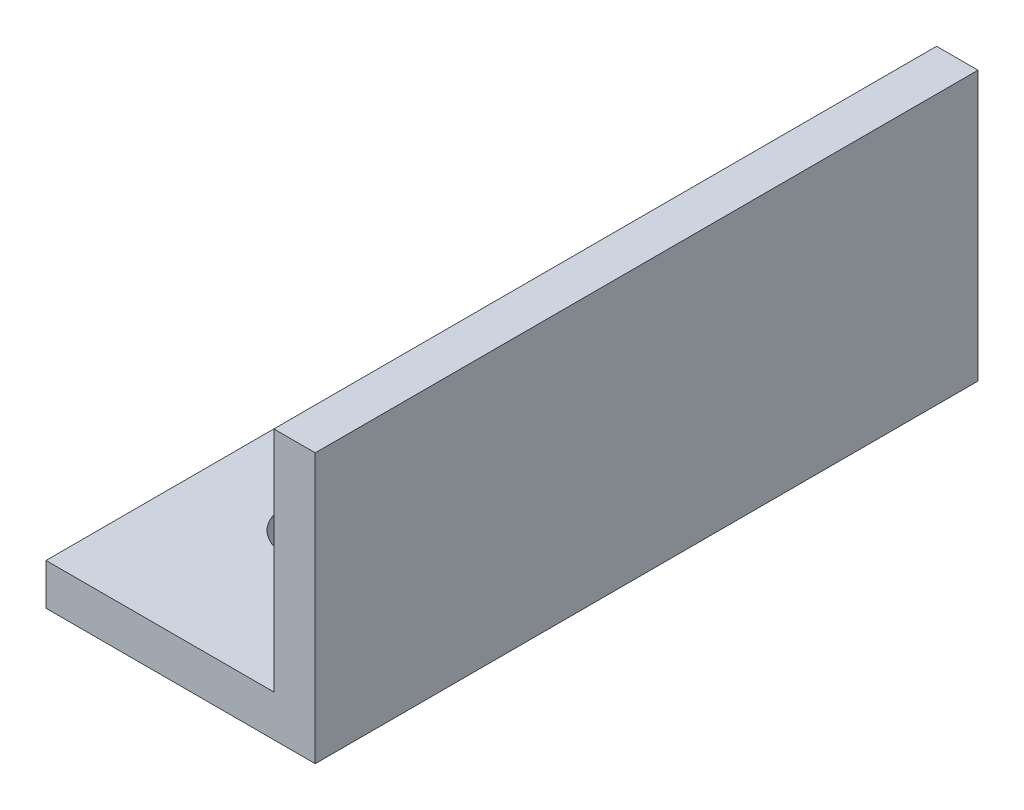
from build123d import *

# Parameters (mm, degrees)
SKETCH1_W           = 11
SKETCH1_H           = 32
BOSS_EXTRUDE1_DEPTH = 2
SKETCH4_W           = 32
SKETCH4_H           = 2
BOSS_EXTRUDE2_DEPTH = 2
SKETCH5_W           = 2
SKETCH5_H           = 32
BOSS_EXTRUDE3_DEPTH = 11
CUT_EXTRUDE6_DEPTH  = 37.249137921


with BuildPart() as part:
    # Sketch1 → Boss-Extrude1 (new body)
    with BuildSketch(Plane(origin=(0, 0, 0), x_dir=(1, 0, 0), z_dir=(0, 1, 0))):
        with Locations((5.5, 16)):
            Rectangle(SKETCH1_W, SKETCH1_H)
    extrude(amount=BOSS_EXTRUDE1_DEPTH)

    # Sketch4 → Boss-Extrude2 (add)
    with BuildSketch(Plane(origin=(11, 0, 0), x_dir=(0, 0, -1), z_dir=(1, 0, 0))):
        with Locations((16, 1)):
            Rectangle(SKETCH4_W, SKETCH4_H)
    extrude(amount=BOSS_EXTRUDE2_DEPTH)

    # Sketch5 → Boss-Extrude3 (add)
    with BuildSketch(Plane(origin=(0, 2, 0), x_dir=(1, 0, 0), z_dir=(0, 1, 0))):
        with Locations((12, 16)):
            Rectangle(SKETCH5_W, SKETCH5_H)
    extrude(amount=BOSS_EXTRUDE3_DEPTH)

    # Sketch6 → Cut-Extrude6 (cut, through all)
    with BuildSketch(Plane(origin=(0, 2, 0), x_dir=(1, 0, 0), z_dir=(0, 1, 0))):
        with BuildLine():
            ThreePointArc((7.5, 8), (6.914213562, 9.414213562), (5.5, 10))
            Line((5.5, 10), (5.5, 6))
            ThreePointArc((5.5, 6), (6.914213562, 6.585786438), (7.5, 8))
        make_face()
        with BuildLine():
            Line((5.5, 6), (5.5, 10))
            ThreePointArc((5.5, 10), (3.5, 8), (5.5, 6))
        make_face()
        with BuildLine():
            ThreePointArc((5.5, 26), (3.5, 24), (5.5, 22))
            Line((5.5, 22), (5.5, 26))
        make_face()
        with BuildLine():
            Line((5.5, 26), (5.5, 22))
            ThreePointArc((5.5, 22), (6.914213562, 22.585786438), (7.5, 24))
            ThreePointArc((7.5, 24), (6.914213562, 25.414213562), (5.5, 26))
        make_face()
    extrude(amount=-CUT_EXTRUDE6_DEPTH, mode=Mode.SUBTRACT)


solid = part.part
